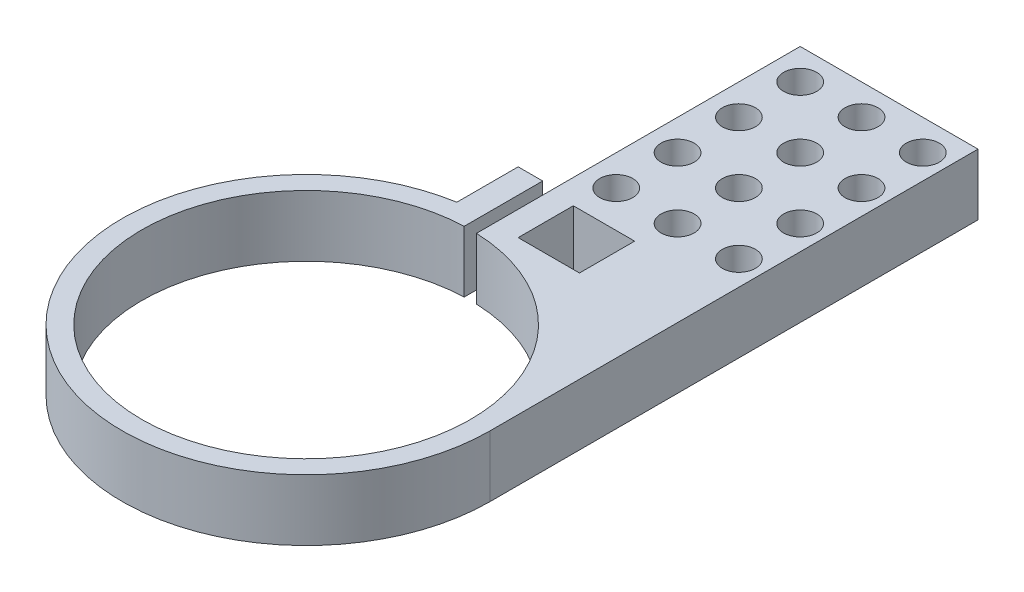
from build123d import *

# Parameters (mm, degrees)
SKETCH1_R           = 38.1
SKETCH1_R_2         = 34.036
BOSS_EXTRUDE1_DEPTH = 12.7
SKETCH2_W           = 12.7
SKETCH2_H           = 12.7
BOSS_EXTRUDE2_DEPTH = 12.7
SKETCH4_W           = 2.54
SKETCH4_H           = 66.350379848
CUT_EXTRUDE2_DEPTH  = 65.340360647
BOSS_EXTRUDE3_REACH = 104.44
BOSS_EXTRUDE3_START = 38.1
SKETCH5_W           = 50.267106623
SKETCH5_H           = 12.7
SKETCH6_W           = 36.83
SKETCH6_H           = 50.8
BOSS_EXTRUDE4_DEPTH = 12.7
SKETCH7_R           = 3.429
SKETCH7_W           = 12.7
SKETCH7_H           = 11.43
CUT_EXTRUDE3_DEPTH  = 109.754126547


with BuildPart() as part:
    # Sketch1 → Boss-Extrude1 (new body)
    with BuildSketch(Plane(origin=(0, 0, 0), x_dir=(1, 0, 0), z_dir=(0, 1, 0))):
        with Locations(Location((0, 0, 0), (0, 0, 270))):
            Circle(SKETCH1_R)
        with Locations(Location((0, 0, 0), (0, 0, 270))):
            Circle(SKETCH1_R_2, mode=Mode.SUBTRACT)
    extrude(amount=BOSS_EXTRUDE1_DEPTH)

    # Sketch2 → Boss-Extrude2 (add)
    with BuildSketch(Plane(origin=(0, 0, 0), x_dir=(1, 0, 0), z_dir=(0, 1, 0))):
        with Locations((0, 43.917106623)):
            Rectangle(SKETCH2_W, SKETCH2_H)
    extrude(amount=BOSS_EXTRUDE2_DEPTH)

    # Sketch4 → Cut-Extrude2 (cut, through all)
    with BuildSketch(Plane(origin=(0, 0, 0), x_dir=(1, 0, 0), z_dir=(0, 1, 0))):
        with Locations((0, 30.686886109)):
            Rectangle(SKETCH4_W, SKETCH4_H)
    extrude(amount=CUT_EXTRUDE2_DEPTH, mode=Mode.SUBTRACT)

    # Sketch5 → Boss-Extrude3 (add, up to next)
    with BuildSketch(Plane(origin=(0, 0, 0), x_dir=(0, 0, -1), z_dir=(1, 0, 0)).offset(BOSS_EXTRUDE3_START), mode=Mode.PRIVATE) as boss_extrude3_sk1:
        with Locations((25.133553312, 6.35)):
            Rectangle(SKETCH5_W, SKETCH5_H)
    boss_extrude3_tool1 = extrude(boss_extrude3_sk1.sketch, amount=-BOSS_EXTRUDE3_REACH, mode=Mode.PRIVATE) - part.part
    add(boss_extrude3_tool1.solids().sort_by_distance((38.1, 6.35, -25.133553))[0])

    # Sketch6 → Boss-Extrude4 (add)
    with BuildSketch(Plane(origin=(0, 12.7, 0), x_dir=(1, 0, 0), z_dir=(0, 1, 0))):
        with Locations((19.685, 75.667106623)):
            Rectangle(SKETCH6_W, SKETCH6_H)
    extrude(amount=-BOSS_EXTRUDE4_DEPTH)

    # Sketch7 → Cut-Extrude3 (cut, through all)
    with BuildSketch(Plane(origin=(0, 0, 0), x_dir=(1, 0, 0), z_dir=(0, 1, 0))):
        with Locations(Location((7.62, 94.717106623, 0), (0, 0, 270))):
            Circle(SKETCH7_R)
        with Locations(Location((20.32, 94.717106623, 0), (0, 0, 270))):
            Circle(SKETCH7_R)
        with Locations(Location((20.32, 82.017106623, 0), (0, 0, 270))):
            Circle(SKETCH7_R)
        with Locations(Location((7.62, 82.017106623, 0), (0, 0, 270))):
            Circle(SKETCH7_R)
        with Locations(Location((33.02, 94.717106623, 0), (0, 0, 270))):
            Circle(SKETCH7_R)
        with Locations(Location((33.02, 82.017106623, 0), (0, 0, 270))):
            Circle(SKETCH7_R)
        with Locations(Location((7.62, 69.317106623, 0), (0, 0, 270))):
            Circle(SKETCH7_R)
        with Locations(Location((20.32, 69.317106623, 0), (0, 0, 270))):
            Circle(SKETCH7_R)
        with Locations(Location((33.02, 69.317106623, 0), (0, 0, 270))):
            Circle(SKETCH7_R)
        with Locations(Location((7.62, 56.617106623, 0), (0, 0, 270))):
            Circle(SKETCH7_R)
        with Locations(Location((20.32, 56.617106623, 0), (0, 0, 270))):
            Circle(SKETCH7_R)
        with Locations(Location((33.02, 56.617106623, 0), (0, 0, 270))):
            Circle(SKETCH7_R)
        with Locations((12.7, 43.282106623)):
            Rectangle(SKETCH7_W, SKETCH7_H)
    extrude(amount=CUT_EXTRUDE3_DEPTH, mode=Mode.SUBTRACT)


solid = part.part
